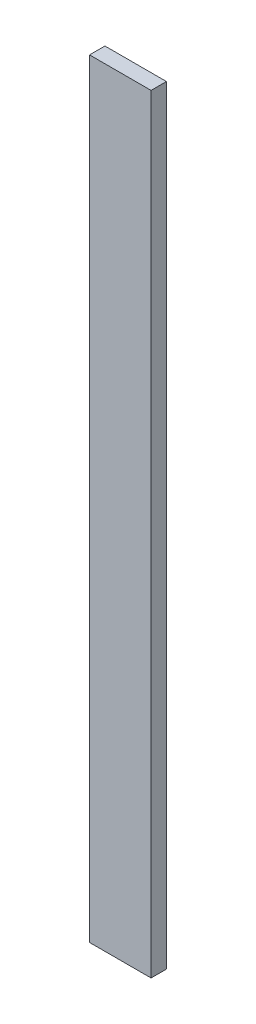
from build123d import *

# Parameters (mm, degrees)
SKETCH1_W           = 20
SKETCH1_H           = 250
BOSS_EXTRUDE1_DEPTH = 5


with BuildPart() as part:
    # Sketch1 → Boss-Extrude1 (new body)
    with BuildSketch(Plane.XY):
        Rectangle(SKETCH1_W, SKETCH1_H)
    extrude(amount=BOSS_EXTRUDE1_DEPTH)


solid = part.part
